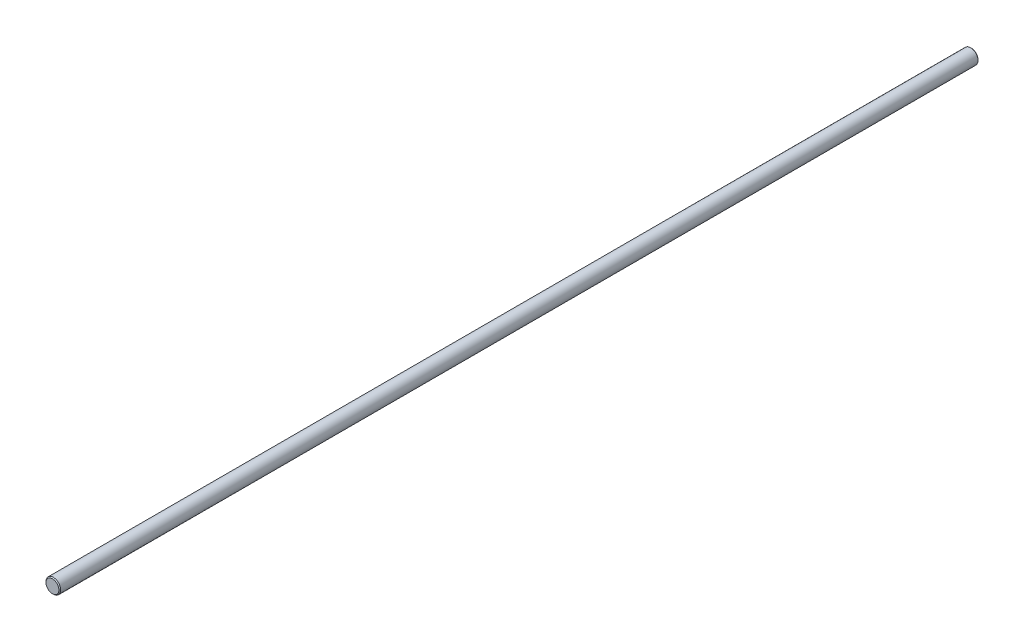
from build123d import *
from OCP.BRepFilletAPI import BRepFilletAPI_MakeChamfer

# Parameters (mm, degrees)
SKETCH1_R           = 4
BOSS_EXTRUDE1_DEPTH = 500
CHAMFER1_SIZE       = 0.5
CHAMFER1_SIZE2      = 0.482844387


with BuildPart() as part:
    # Sketch1 → Boss-Extrude1 (new body)
    with BuildSketch(Plane.XY):
        Circle(SKETCH1_R)
    extrude(amount=BOSS_EXTRUDE1_DEPTH)

    # Chamfer1: one chamfer whose edges measure the first distance from different faces: ONE call of the kernel's chamfer builder (chamfer() names one face for all edges)
    chamfer1_edges_1 = [part.edges().sort_by_distance(p)[0] for p in [
        (-4, 0, 0),
    ]]
    chamfer1_side_1 = [part.faces().sort_by_distance(p)[0] for p in [
        (0, 0, 0),
    ]]
    chamfer1_edges_2 = [part.edges().sort_by_distance(p)[0] for p in [
        (-4, 0, 500),
    ]]
    chamfer1_side_2 = [part.faces().sort_by_distance(p)[0] for p in [
        (-4, 0, 250),
    ]]
    chamfer1 = BRepFilletAPI_MakeChamfer(part.part.solid().wrapped)
    for e in chamfer1_edges_1:
        chamfer1.Add(CHAMFER1_SIZE, CHAMFER1_SIZE2, e.wrapped, chamfer1_side_1[0].wrapped)  # the first distance lies on this face
    for e in chamfer1_edges_2:
        chamfer1.Add(CHAMFER1_SIZE, CHAMFER1_SIZE2, e.wrapped, chamfer1_side_2[0].wrapped)  # the first distance lies on this face
    add(Compound.cast(chamfer1.Shape()), mode=Mode.REPLACE)


solid = part.part
